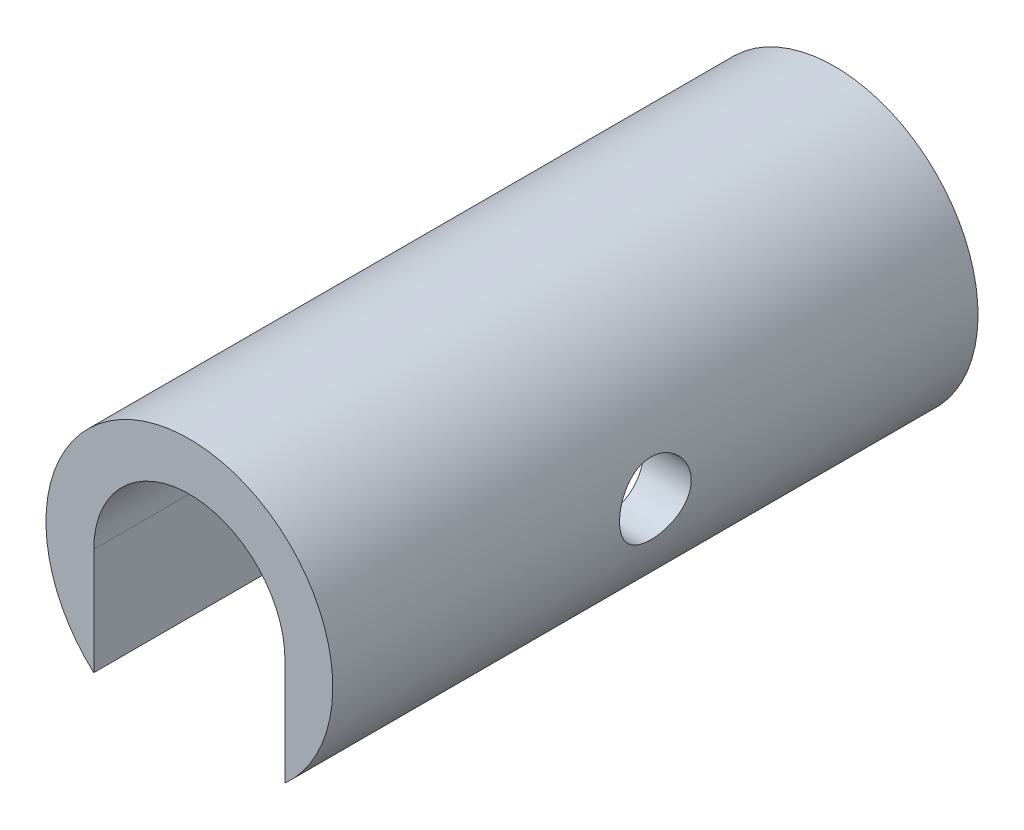
from build123d import *

# Parameters (mm, degrees)
SALIENTE_EXTRUIR1_DEPTH = 27
CROQUIS2_R              = 1.5
CORTAR_EXTRUIR1_DEPTH   = 13.5


with BuildPart() as part:
    # Croquis1 → Saliente-Extruir1 (new body)
    with BuildSketch(Plane(origin=(0, 0, 0), x_dir=(0, 1, 0), z_dir=(0, 0, 1))):
        with BuildLine():
            Line((0, 4), (-4.472135955, 4))
            ThreePointArc((-4.472135955, 4), (6, 0), (-4.472135955, -4))
            Line((-4.472135955, -4), (0, -4))
            ThreePointArc((0, -4), (4, 0), (0, 4))
        make_face()
    extrude(amount=SALIENTE_EXTRUIR1_DEPTH)

    # Croquis2 → Cortar-Extruir1 (cut, symmetric)
    with BuildSketch(Plane.YZ):
        with Locations(Location((0, 13.5, 0), (0, 0, 270))):
            Circle(CROQUIS2_R)
    extrude(amount=CORTAR_EXTRUIR1_DEPTH, both=True, mode=Mode.SUBTRACT)


solid = part.part
